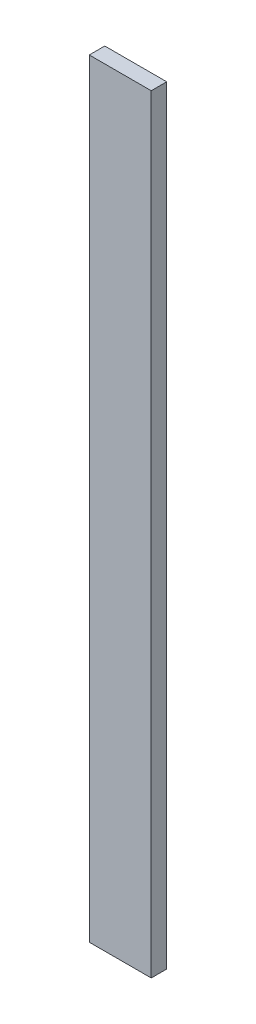
from build123d import *

# Parameters (mm, degrees)
SKETCH1_W           = 6.35
SKETCH1_H           = 78.741148021
BOSS_EXTRUDE1_DEPTH = 1.5875


with BuildPart() as part:
    # Sketch1 → Boss-Extrude1 (new body)
    with BuildSketch(Plane.XY):
        with Locations((2.762250354, 256.402590323)):
            Rectangle(SKETCH1_W, SKETCH1_H)
    extrude(amount=BOSS_EXTRUDE1_DEPTH)


solid = part.part
